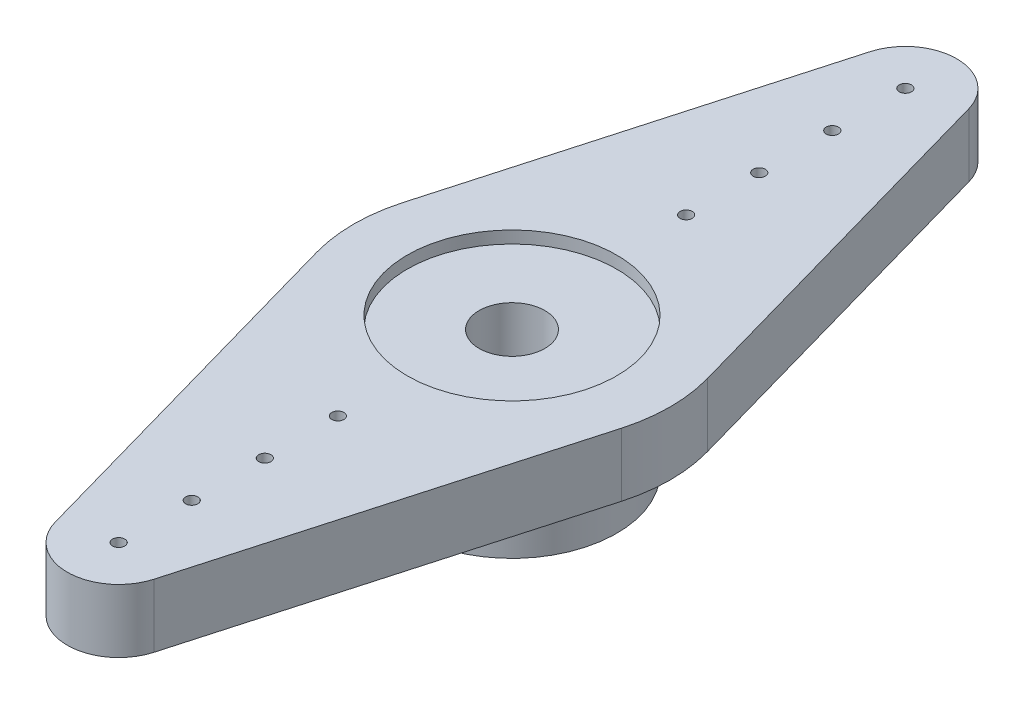
from build123d import *

# Parameters (mm, degrees)
SKETCH2_R                = 4.3
SKETCH2_R_2              = 2.75
BOSS_EXTRUDE1_DEPTH      = 3
SKETCH3_R                = 4.3
SKETCH3_R_2              = 1.35
BOSS_EXTRUDE2_DEPTH      = 2.1
BOSS_EXTRUDE3_DEPTH      = 0.5
BOSS_EXTRUDE3_DEPTH_BACK = 2.1
SKETCH4_R                = 4.3
SKETCH4_R_2              = 0.25


with BuildPart() as part:
    # Sketch2 → Boss-Extrude1 (new body)
    with BuildSketch(Plane(origin=(0, 0, 0), x_dir=(1, 0, 0), z_dir=(0, 1, 0))):
        with Locations(Location((0, 0, 0), (0, 0, 270))):
            Circle(SKETCH2_R)
        with Locations(Location((0, 0, 0), (0, 0, 270))):
            Circle(SKETCH2_R_2, mode=Mode.SUBTRACT)
    extrude(amount=BOSS_EXTRUDE1_DEPTH)



with BuildPart() as body_2:
    # Sketch3 → Boss-Extrude2 (new body)
    with BuildSketch(Plane(origin=(0, 3, 0), x_dir=(1, 0, 0), z_dir=(0, 1, 0))):
        with Locations(Location((0, 0, 0), (0, 0, 270))):
            Circle(SKETCH3_R)
        with Locations(Location((0, 0, 0), (0, 0, 270))):
            Circle(SKETCH3_R_2, mode=Mode.SUBTRACT)
    extrude(amount=BOSS_EXTRUDE2_DEPTH)


with BuildPart() as part_1:
    add(part.part)

    add(body_2.part)  # Boss-Extrude3 merges body 2
    # Sketch4 → Boss-Extrude3 (add, two sides: drawn at the far end of the back side and taken through both)
    with BuildSketch(Plane(origin=(0, 5.1, 0), x_dir=(1, 0, 0), z_dir=(0, 1, 0)).offset(-BOSS_EXTRUDE3_DEPTH_BACK)):
        with BuildLine():
            Line((-2.030550566, 16.72355418), (-6.25525056, 1.766873065))
            ThreePointArc((-6.25525056, 1.766873065), (-6.5, 0), (-6.25525056, -1.766873065))
            Line((-6.25525056, -1.766873065), (-2.030550566, -16.72355418))
            ThreePointArc((-2.030550566, -16.72355418), (0, -18.26), (2.030550566, -16.72355418))
            Line((2.030550566, -16.72355418), (6.25525056, -1.766873065))
            ThreePointArc((6.25525056, -1.766873065), (6.5, 0), (6.25525056, 1.766873065))
            Line((6.25525056, 1.766873065), (2.030550566, 16.72355418))
            ThreePointArc((2.030550566, 16.72355418), (0, 18.26), (-2.030550566, 16.72355418))
        make_face()
        with Locations(Location((0, 0, 0), (0, 0, 270))):
            Circle(SKETCH4_R, mode=Mode.SUBTRACT)
        with Locations(Location((0, 16.15, 0), (0, 0, 270))):
            Circle(SKETCH4_R_2, mode=Mode.SUBTRACT)
        with Locations(Location((0, 13.15, 0), (0, 0, 270))):
            Circle(SKETCH4_R_2, mode=Mode.SUBTRACT)
        with Locations(Location((0, 10.15, 0), (0, 0, 270))):
            Circle(SKETCH4_R_2, mode=Mode.SUBTRACT)
        with Locations(Location((0, 7.15, 0), (0, 0, 270))):
            Circle(SKETCH4_R_2, mode=Mode.SUBTRACT)
        with Locations(Location((0, -7.15, 0), (0, 0, 90))):
            Circle(SKETCH4_R_2, mode=Mode.SUBTRACT)
        with Locations(Location((0, -10.15, 0), (0, 0, 90))):
            Circle(SKETCH4_R_2, mode=Mode.SUBTRACT)
        with Locations(Location((0, -13.15, 0), (0, 0, 90))):
            Circle(SKETCH4_R_2, mode=Mode.SUBTRACT)
        with Locations(Location((0, -16.15, 0), (0, 0, 90))):
            Circle(SKETCH4_R_2, mode=Mode.SUBTRACT)
    extrude(amount=BOSS_EXTRUDE3_DEPTH + BOSS_EXTRUDE3_DEPTH_BACK)


solid = part_1.part
